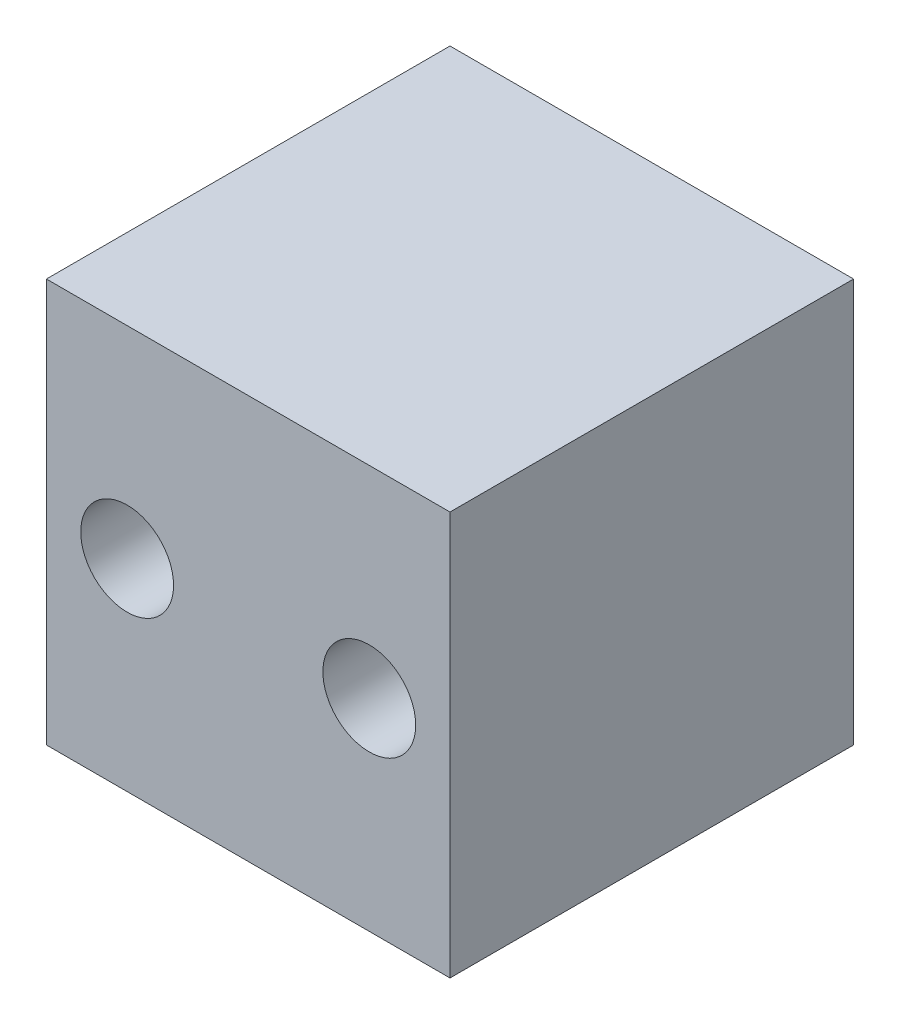
from build123d import *

# Parameters (mm, degrees)
SKIZZE1_W                                           = 100
SKIZZE1_H                                           = 100
AUFSATZ_LINEAR_AUSTRAGEN1_DEPTH                     = 100
STIRNSENKUNG_F_R_M8_SENKSCHRAUBE_KOPF_B_D           = 9
STIRNSENKUNG_F_R_M8_SENKSCHRAUBE_KOPF_B_CBORE_D     = 23
STIRNSENKUNG_F_R_M8_SENKSCHRAUBE_KOPF_B_CBORE_DEPTH = 90


with BuildPart() as part:
    # Skizze1 → Aufsatz-Linear austragen1 (new body)
    with BuildSketch(Plane.XY):
        Rectangle(SKIZZE1_W, SKIZZE1_H)
    extrude(amount=AUFSATZ_LINEAR_AUSTRAGEN1_DEPTH)

    # Stirnsenkung für M8 Senkschraube (Kopf Button)1 (through all)
    with Locations(Plane.XY.offset(100)):
        with Locations((-30, 0)):
            stirnsenkung_f_r_m8_senkschraube_kopf_b = CounterBoreHole(STIRNSENKUNG_F_R_M8_SENKSCHRAUBE_KOPF_B_D / 2, STIRNSENKUNG_F_R_M8_SENKSCHRAUBE_KOPF_B_CBORE_D / 2, STIRNSENKUNG_F_R_M8_SENKSCHRAUBE_KOPF_B_CBORE_DEPTH)

    # Spiegeln1: Stirnsenkung für M8 Senkschraube (Kopf Button)1 across plane
    add(stirnsenkung_f_r_m8_senkschraube_kopf_b.mirror(Plane(origin=(0, 0, 0), x_dir=(0, 0, 1), z_dir=(1, 0, 0))), mode=Mode.SUBTRACT)


solid = part.part
